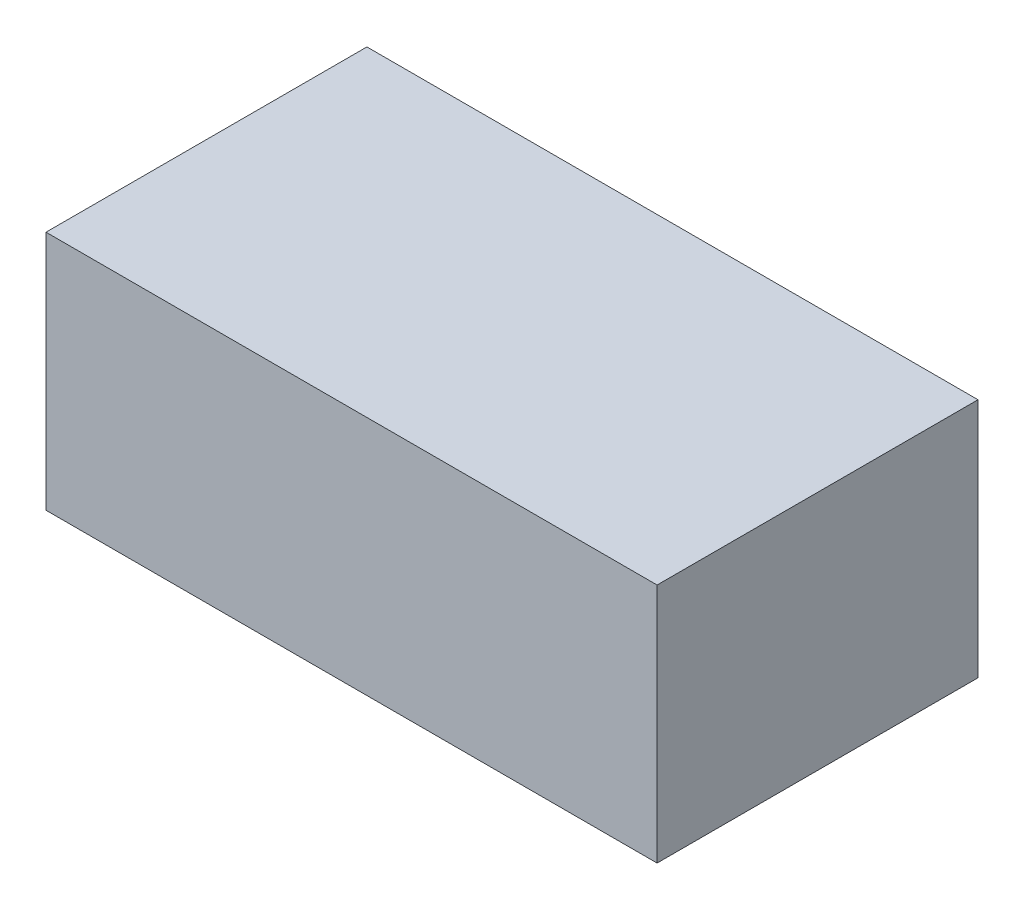
from build123d import *

# Parameters (mm, degrees)
ESQUISSE1_W        = 10.15
ESQUISSE1_H        = 5.33
BOSS_EXTRU_1_DEPTH = 4


with BuildPart() as part:
    # Esquisse1 → Boss.-Extru.1 (new body)
    with BuildSketch(Plane(origin=(0, 0, 0), x_dir=(1, 0, 0), z_dir=(0, 1, 0))):
        Rectangle(ESQUISSE1_W, ESQUISSE1_H)
    extrude(amount=BOSS_EXTRU_1_DEPTH)


solid = part.part
